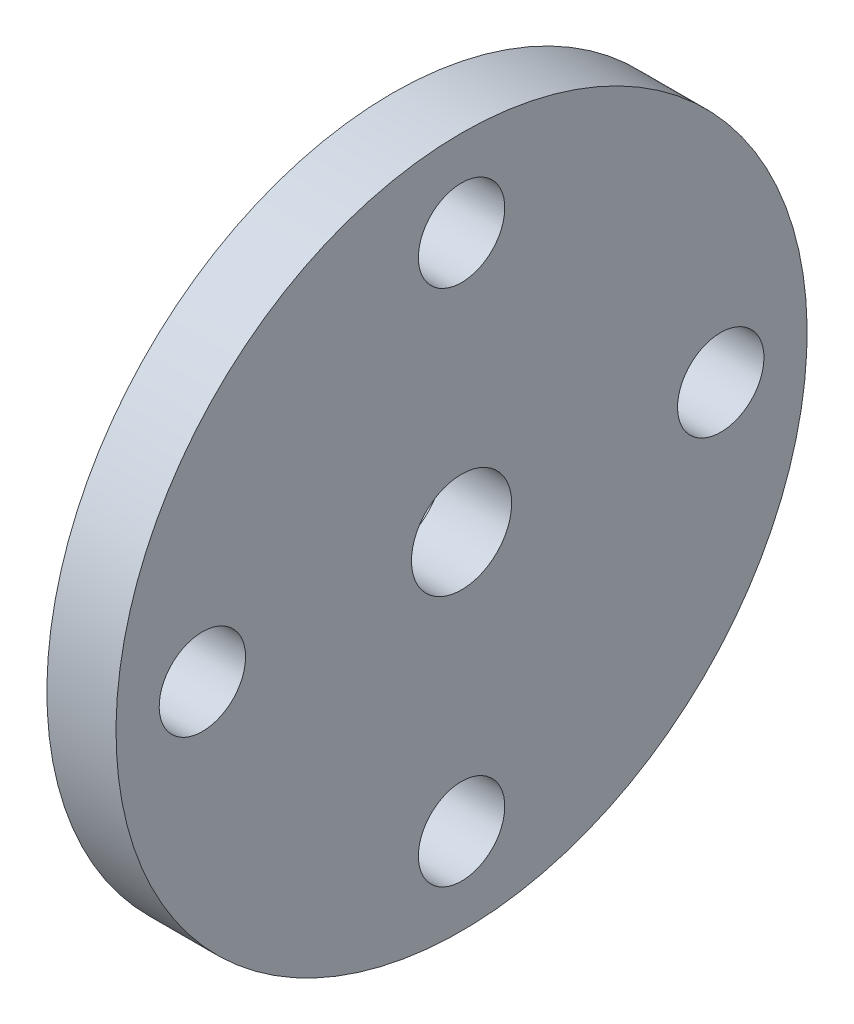
from build123d import *

# Parameters (mm, degrees)
ESQUISSE2_R             = 1.45
ESQUISSE2_R_2           = 1.25
ENL_V_MAT_EXTRU_1_DEPTH = 10


with BuildPart() as part:
    # Esquisse1 → Révolution1 (revolve)
    with BuildSketch(Plane.XY):
        Polygon((0, 3), (0, 4.7), (3, 4.7), (3, 10), (5, 10), (5, 0), (3, 0), (3, 3), align=None)
    revolve(axis=Axis((5, 0, 0), (-1, 0, 0)))

    # Esquisse2 → Enlèv. mat.-Extru.1 (cut)
    with BuildSketch(Plane(origin=(5, 0, 0), x_dir=(0, 0, -1), z_dir=(1, 0, 0))):
        with Locations(Location((0, 0, 0), (0, 0, 90))):
            Circle(ESQUISSE2_R)
        with Locations(Location((0, 7.5, 0), (0, 0, 90))):
            Circle(ESQUISSE2_R_2)
        with Locations(Location((7.5, 0, 0), (0, 0, 90))):
            Circle(ESQUISSE2_R_2)
        with Locations(Location((0, -7.5, 0), (0, 0, 90))):
            Circle(ESQUISSE2_R_2)
        with Locations(Location((-7.5, 0, 0), (0, 0, 90))):
            Circle(ESQUISSE2_R_2)
    extrude(amount=-ENL_V_MAT_EXTRU_1_DEPTH, mode=Mode.SUBTRACT)


solid = part.part
